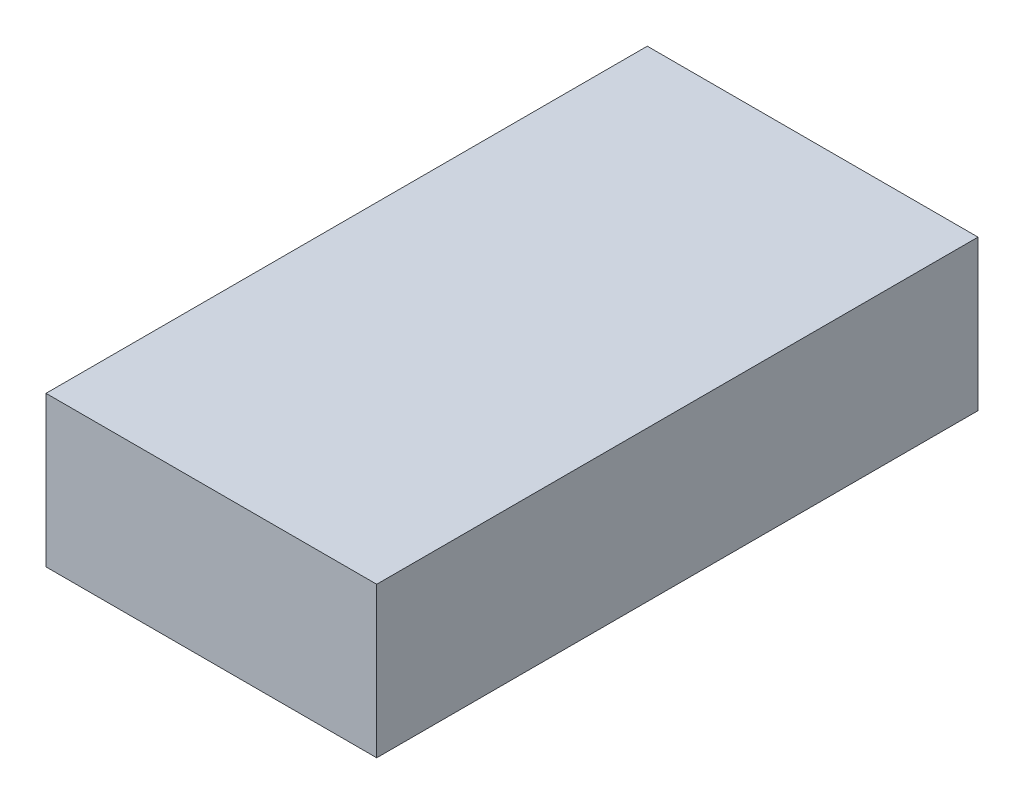
from build123d import *

# Parameters (mm, degrees)
SKETCH1_W           = 110
SKETCH1_H           = 50
BOSS_EXTRUDE1_DEPTH = 200


with BuildPart() as part:
    # Sketch1 → Boss-Extrude1 (new body)
    with BuildSketch(Plane.XY):
        with Locations((55, 25)):
            Rectangle(SKETCH1_W, SKETCH1_H)
    extrude(amount=BOSS_EXTRUDE1_DEPTH)


solid = part.part
